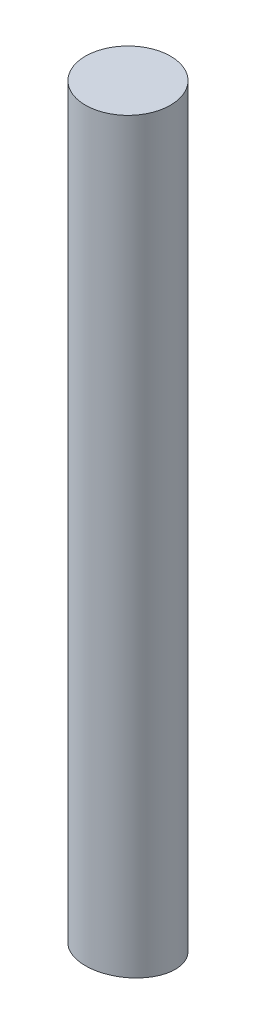
from build123d import *

# Parameters (mm, degrees)
SKETCH_1_R          = 45
EXTRUDE_1_DEPTH     = 800
SKETCH_3_R          = 328.495421983
CUT_EXTRUDE_1_DEPTH = 20


with BuildPart() as part:
    # 草图1 → 凸台-拉伸1 (new body)
    with BuildSketch(Plane.XZ):
        with Locations(Location((-208, -27, 0), (0, 0, 270))):
            Circle(SKETCH_1_R)
    extrude(amount=EXTRUDE_1_DEPTH)

    # 草图3 → 切除-拉伸1 (cut)
    with BuildSketch(Plane(origin=(0, -779.409102269, 95.699404386), x_dir=(1, 0, 0), z_dir=(0, -0.992546151641322, 0.12186934340514774))):
        Circle(SKETCH_3_R)
    extrude(amount=CUT_EXTRUDE_1_DEPTH, mode=Mode.SUBTRACT)


solid = part.part
